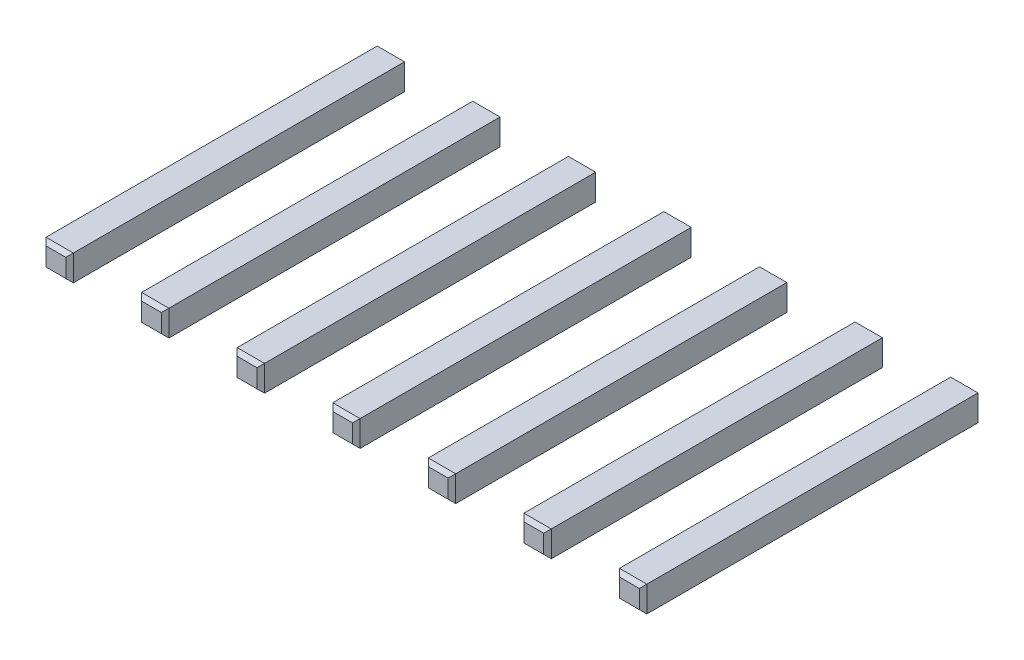
from build123d import *

# Parameters (mm, degrees)
SKETCH_1_W        = 0.726353624
SKETCH_1_H        = 0.687321186
EXTRUDE_1_DEPTH   = 9
EXTRUDE_1_2_DEPTH = 9
EXTRUDE_1_3_DEPTH = 9
EXTRUDE_1_4_DEPTH = 9
EXTRUDE_1_5_DEPTH = 9
EXTRUDE_1_6_DEPTH = 9
EXTRUDE_1_7_DEPTH = 9
CHAMFER_1_SIZE    = 0.1
CHAMFER_2_SIZE    = 0.1
CHAMFER_3_SIZE    = 0.1
CHAMFER_4_SIZE    = 0.1
CHAMFER_5_SIZE    = 0.1
CHAMFER_6_SIZE    = 0.1
CHAMFER_7_SIZE    = 0.1
CHAMFER_8_SIZE    = 0.1
CHAMFER_9_SIZE    = 0.1
CHAMFER_10_SIZE   = 0.1
CHAMFER_11_SIZE   = 0.1
CHAMFER_12_SIZE   = 0.1
CHAMFER_13_SIZE   = 0.1
CHAMFER_14_SIZE   = 0.1


with BuildPart() as part:
    # 草图1 → 凸台-拉伸1 (new body)
    with BuildSketch(Plane.XY):
        with Locations((2.54, 0)):
            Rectangle(SKETCH_1_W, SKETCH_1_H)
    extrude(amount=EXTRUDE_1_DEPTH)

    # 倒角6
    chamfer_6_edges = [part.edges().sort_by_distance(p)[0] for p in [
        (2.54, -0.343660593, 0),
        (2.176823188, 0, 0),
        (2.54, 0.343660593, 0),
        (2.903176812, 0, 0),
    ]]
    chamfer(chamfer_6_edges, length=CHAMFER_6_SIZE)

    # 倒角13
    chamfer_13_edges = [part.edges().sort_by_distance(p)[0] for p in [
        (2.176823188, 0, 9),
        (2.54, -0.343660593, 9),
        (2.903176812, 0, 9),
        (2.54, 0.343660593, 9),
    ]]
    chamfer(chamfer_13_edges, length=CHAMFER_13_SIZE)


with BuildPart() as body_2:
    # 草图1 → Extrude 1 2 (new body)
    with BuildSketch(Plane.XY):
        Rectangle(SKETCH_1_W, SKETCH_1_H)
    extrude(amount=EXTRUDE_1_2_DEPTH)

    # 倒角7
    chamfer_7_edges = [body_2.edges().sort_by_distance(p)[0] for p in [
        (0, -0.343660593, 0),
        (-0.363176812, 0, 0),
        (0, 0.343660593, 0),
        (0.363176812, 0, 0),
    ]]
    chamfer(chamfer_7_edges, length=CHAMFER_7_SIZE)

    # 倒角14
    chamfer_14_edges = [body_2.edges().sort_by_distance(p)[0] for p in [
        (-0.363176812, 0, 9),
        (0, -0.343660593, 9),
        (0.363176812, 0, 9),
        (0, 0.343660593, 9),
    ]]
    chamfer(chamfer_14_edges, length=CHAMFER_14_SIZE)


with BuildPart() as body_3:
    # 草图1 → Extrude 1 3 (new body)
    with BuildSketch(Plane.XY):
        with Locations((5.08, 0)):
            Rectangle(SKETCH_1_W, SKETCH_1_H)
    extrude(amount=EXTRUDE_1_3_DEPTH)

    # 倒角5
    chamfer_5_edges = [body_3.edges().sort_by_distance(p)[0] for p in [
        (5.08, -0.343660593, 0),
        (4.716823188, 0, 0),
        (5.08, 0.343660593, 0),
        (5.443176812, 0, 0),
    ]]
    chamfer(chamfer_5_edges, length=CHAMFER_5_SIZE)

    # 倒角12
    chamfer_12_edges = [body_3.edges().sort_by_distance(p)[0] for p in [
        (4.716823188, 0, 9),
        (5.08, -0.343660593, 9),
        (5.443176812, 0, 9),
        (5.08, 0.343660593, 9),
    ]]
    chamfer(chamfer_12_edges, length=CHAMFER_12_SIZE)


with BuildPart() as body_4:
    # 草图1 → Extrude 1 4 (new body)
    with BuildSketch(Plane.XY):
        with Locations((7.62, 0)):
            Rectangle(SKETCH_1_W, SKETCH_1_H)
    extrude(amount=EXTRUDE_1_4_DEPTH)

    # 倒角4
    chamfer_4_edges = [body_4.edges().sort_by_distance(p)[0] for p in [
        (7.62, -0.343660593, 0),
        (7.256823188, 0, 0),
        (7.62, 0.343660593, 0),
        (7.983176812, 0, 0),
    ]]
    chamfer(chamfer_4_edges, length=CHAMFER_4_SIZE)

    # 倒角11
    chamfer_11_edges = [body_4.edges().sort_by_distance(p)[0] for p in [
        (7.256823188, 0, 9),
        (7.62, -0.343660593, 9),
        (7.983176812, 0, 9),
        (7.62, 0.343660593, 9),
    ]]
    chamfer(chamfer_11_edges, length=CHAMFER_11_SIZE)


with BuildPart() as body_5:
    # 草图1 → Extrude 1 5 (new body)
    with BuildSketch(Plane.XY):
        with Locations((10.16, 0)):
            Rectangle(SKETCH_1_W, SKETCH_1_H)
    extrude(amount=EXTRUDE_1_5_DEPTH)

    # 倒角3
    chamfer_3_edges = [body_5.edges().sort_by_distance(p)[0] for p in [
        (10.16, -0.343660593, 0),
        (9.796823188, 0, 0),
        (10.16, 0.343660593, 0),
        (10.523176812, 0, 0),
    ]]
    chamfer(chamfer_3_edges, length=CHAMFER_3_SIZE)

    # 倒角10
    chamfer_10_edges = [body_5.edges().sort_by_distance(p)[0] for p in [
        (9.796823188, 0, 9),
        (10.16, -0.343660593, 9),
        (10.523176812, 0, 9),
        (10.16, 0.343660593, 9),
    ]]
    chamfer(chamfer_10_edges, length=CHAMFER_10_SIZE)


with BuildPart() as body_6:
    # 草图1 → Extrude 1 6 (new body)
    with BuildSketch(Plane.XY):
        with Locations((12.7, 0)):
            Rectangle(SKETCH_1_W, SKETCH_1_H)
    extrude(amount=EXTRUDE_1_6_DEPTH)

    # 倒角2
    chamfer_2_edges = [body_6.edges().sort_by_distance(p)[0] for p in [
        (12.7, -0.343660593, 0),
        (12.336823188, 0, 0),
        (12.7, 0.343660593, 0),
        (13.063176812, 0, 0),
    ]]
    chamfer(chamfer_2_edges, length=CHAMFER_2_SIZE)

    # 倒角9
    chamfer_9_edges = [body_6.edges().sort_by_distance(p)[0] for p in [
        (12.336823188, 0, 9),
        (12.7, -0.343660593, 9),
        (13.063176812, 0, 9),
        (12.7, 0.343660593, 9),
    ]]
    chamfer(chamfer_9_edges, length=CHAMFER_9_SIZE)


with BuildPart() as body_7:
    # 草图1 → Extrude 1 7 (new body)
    with BuildSketch(Plane.XY):
        with Locations((15.24, 0)):
            Rectangle(SKETCH_1_W, SKETCH_1_H)
    extrude(amount=EXTRUDE_1_7_DEPTH)

    # 倒角1
    chamfer_1_edges = [body_7.edges().sort_by_distance(p)[0] for p in [
        (15.24, -0.343660593, 0),
        (14.876823188, 0, 0),
        (15.24, 0.343660593, 0),
        (15.603176812, 0, 0),
    ]]
    chamfer(chamfer_1_edges, length=CHAMFER_1_SIZE)

    # 倒角8
    chamfer_8_edges = [body_7.edges().sort_by_distance(p)[0] for p in [
        (14.876823188, 0, 9),
        (15.24, -0.343660593, 9),
        (15.603176812, 0, 9),
        (15.24, 0.343660593, 9),
    ]]
    chamfer(chamfer_8_edges, length=CHAMFER_8_SIZE)


solid = Compound([part.part, body_2.part, body_3.part, body_4.part, body_5.part, body_6.part, body_7.part])
